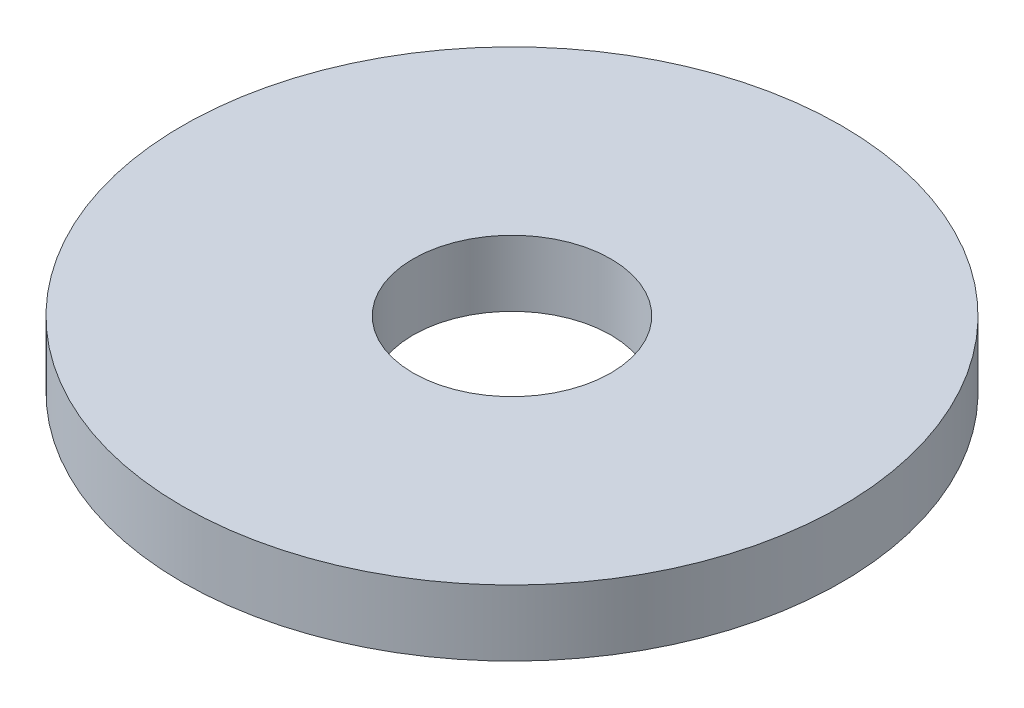
from build123d import *

# Parameters (mm, degrees)
SKETCH_1_R      = 5
SKETCH_1_R_2    = 1.5
EXTRUDE_1_DEPTH = 1


with BuildPart() as part:
    # 草图1 → 凸台-拉伸1 (new body)
    with BuildSketch(Plane(origin=(0, 0, 0), x_dir=(1, 0, 0), z_dir=(0, 1, 0))):
        with Locations(Location((0, 0, 0), (0, 0, 270))):
            Circle(SKETCH_1_R)
        with Locations(Location((0, 0, 0), (0, 0, 270))):
            Circle(SKETCH_1_R_2, mode=Mode.SUBTRACT)
    extrude(amount=EXTRUDE_1_DEPTH)


solid = part.part
